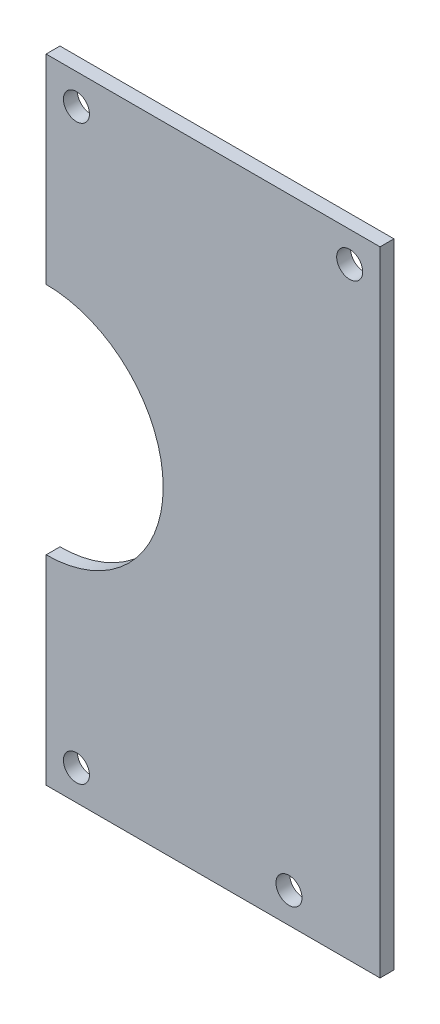
from build123d import *

# Parameters (mm, degrees)
BOSS_EXTRUDE1_DEPTH = 1.6
SKETCH4_R           = 1.5
CUT_EXTRUDE1_DEPTH  = 54.075983269


with BuildPart() as part:
    # Sketch3 → Boss-Extrude1 (new body)
    with BuildSketch(Plane.XY):
        with BuildLine():
            Line((13.5, 36.5), (38.5, 36.5))
            Line((38.5, 36.5), (38.5, -36.5))
            Line((38.5, -36.5), (13.5, -36.5))
            Line((13.5, -36.5), (0, -36.5))
            Line((0, -36.5), (0, -13.5))
            ThreePointArc((0, -13.5), (13.5, 0), (0, 13.5))
            Line((0, 13.5), (0, 36.5))
            Line((0, 36.5), (13.5, 36.5))
        make_face()
    extrude(amount=-BOSS_EXTRUDE1_DEPTH)

    # Sketch4 → Cut-Extrude1 (cut, through all)
    with BuildSketch(Plane.XY):
        with Locations(Location((35, 33, 0), (0, 0, 180))):
            Circle(SKETCH4_R)
        with Locations((3.5, -33)):
            Circle(SKETCH4_R)
        with Locations(Location((3.5, 33, 0), (0, 0, 180))):
            Circle(SKETCH4_R)
        with Locations((28, -33)):
            Circle(SKETCH4_R)
    extrude(amount=-CUT_EXTRUDE1_DEPTH, mode=Mode.SUBTRACT)


solid = part.part
